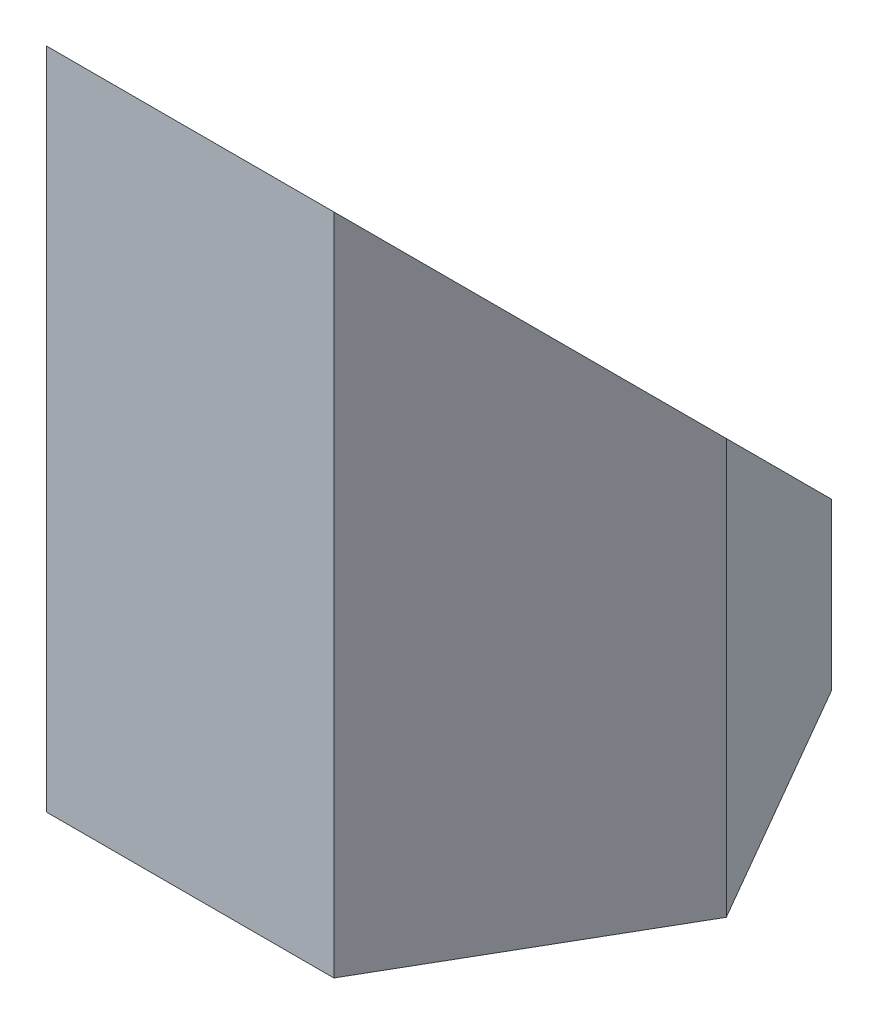
from build123d import *

# Parameters (mm, degrees)
SKETCH13_W          = 69.282032303
SKETCH13_H          = 60
BOSS_EXTRUDE3_DEPTH = 80
CUT_EXTRUDE5_DEPTH  = 80
SKETCH15_R          = 12
CUT_EXTRUDE6_DEPTH  = 80


with BuildPart() as part:
    # Sketch13 → Boss-Extrude3 (new body)
    with BuildSketch(Plane(origin=(0, 0, 0), x_dir=(1, 0, 0), z_dir=(0, 1, 0))):
        with Locations((-34.641016152, -30)):
            Rectangle(SKETCH13_W, SKETCH13_H)
    extrude(amount=BOSS_EXTRUDE3_DEPTH)

    # Sketch14 → Cut-Extrude5 (cut)
    with BuildSketch(Plane(origin=(0, 0, 0), x_dir=(0, 0, -1), z_dir=(1, 0, 0))):
        Polygon((-60, 80), (0, 20), (0, 80), align=None)
    extrude(amount=-CUT_EXTRUDE5_DEPTH, mode=Mode.SUBTRACT)

    # Sketch15 → Cut-Extrude6 (cut)
    with BuildSketch(Plane(origin=(0, 0, 0), x_dir=(-1, 0, 0), z_dir=(0, -1, 0))):
        Polygon((69.282032303, -30), (51.961524227, -60), (69.282032303, -60), align=None)
        Polygon((51.961524227, 0), (69.282032303, -30), (69.282032303, 0), align=None)
        Polygon((0, -60), (17.320508076, -60), (0, -30), align=None)
        Polygon((0, 0), (0, -30), (17.320508076, 0), align=None)
        with Locations(Location((34.641016151, -30, 0), (0, 0, 90))):
            Circle(SKETCH15_R)
    extrude(amount=-CUT_EXTRUDE6_DEPTH, mode=Mode.SUBTRACT)


solid = part.part
